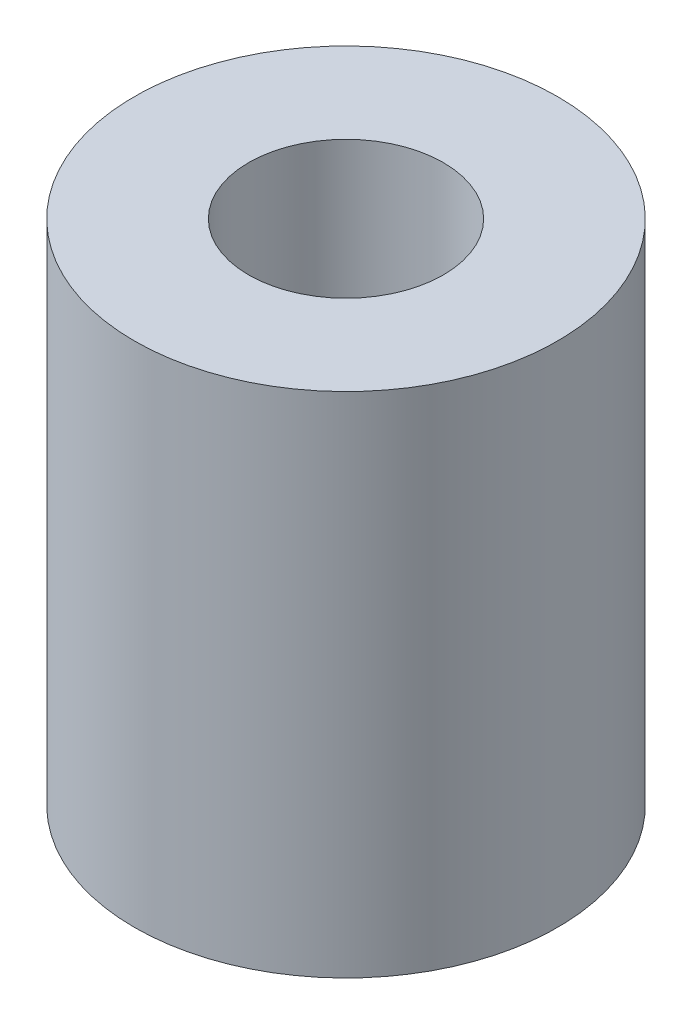
from build123d import *

# Parameters (mm, degrees)
SKETCH1_W = 2.7
SKETCH1_H = 12


with BuildPart() as part:
    # Sketch1 → Revolve1 (revolve)
    with BuildSketch(Plane.XY, mode=Mode.PRIVATE) as revolve1_sk:
        with Locations((3.65, 6)):
            Rectangle(SKETCH1_W, SKETCH1_H)
    revolve(revolve1_sk.sketch.rotate(Axis((0, 0, 0), (0, 1, 0)), 90), axis=Axis((0, 0, 0), (0, 1, 0)))


solid = part.part
